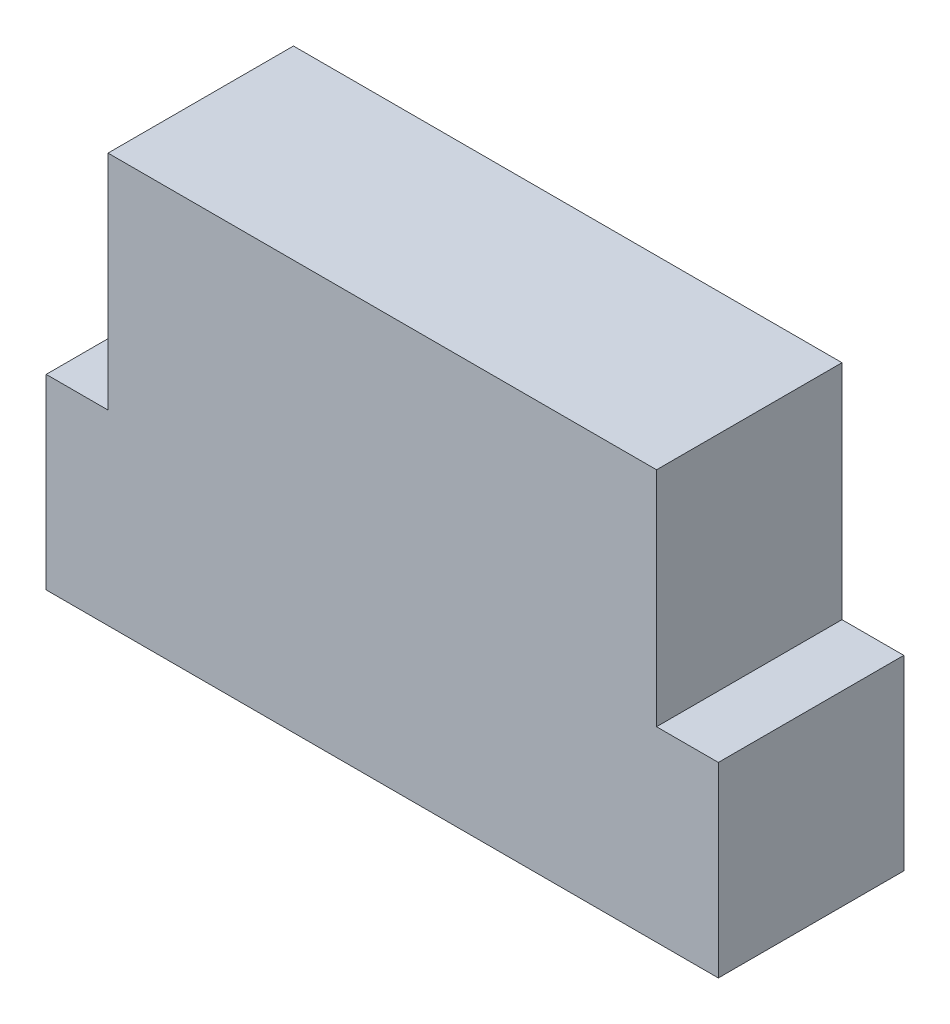
from build123d import *

# Parameters (mm, degrees)
EXTRUDE_1_DEPTH     = 2
EXTRUDE_5_DEPTH     = 12
SKETCH_3_R          = 2
EXTRUDE_6_DEPTH     = 12
CUT_EXTRUDE_1_DEPTH = 12
EXTRUDE_7_DEPTH     = 15
SKETCH_7_W          = 44.36597813
SKETCH_7_H          = 14
EXTRUDE_8_DEPTH     = 3
SKETCH_9_W          = 18.66
SKETCH_9_H          = 10
CUT_EXTRUDE_3_DEPTH = 1
EXTRUDE_9_DEPTH     = 1
SCALE_1_SCALE       = 0.1
SKETCH_11_W         = 1.5
SKETCH_11_H         = 1.51
EXTRUDE_10_DEPTH    = 0.5
SKETCH_12_W         = 1.5
SKETCH_12_H         = 1.51
EXTRUDE_11_DEPTH    = 0.5
SKETCH_13_W         = 5.436597812
SKETCH_13_H         = 1.51
EXTRUDE_12_DEPTH    = 1.5


with BuildPart() as part:
    # 스케치2 → 보스-돌출1 (new body)
    with BuildSketch(Plane.XY):
        Polygon((0, 0), (47.71, 0), (37.32, -17.996007891), (10.39, -17.996007891), align=None)
    extrude(amount=EXTRUDE_1_DEPTH)

    # 스케치4 → 보스-돌출5 (add)
    with BuildSketch(Plane.XY.offset(2)):
        Polygon((13.739529946, -17.996007891), (5.021540881, -2.896007891), (1.672010935, -2.896007891), (10.39, -17.996007891), align=None)
        Polygon((46.037989065, -2.896007891), (42.688459119, -2.896007891), (33.970470054, -17.996007891), (37.32, -17.996007891), align=None)
    extrude(amount=EXTRUDE_5_DEPTH)

    # 스케치3 → 보스-돌출6 (add)
    with BuildSketch(Plane.XY.offset(2)):
        with Locations(Location((15.355, -11.594084102, 0), (0, 0, 180))):
            Circle(SKETCH_3_R)
        with Locations((32.355, -11.594084102)):
            Circle(SKETCH_3_R)
    extrude(amount=EXTRUDE_6_DEPTH)

    # 스케치5 → 컷-돌출1 (cut)
    with BuildSketch(Plane.XY.offset(2)):
        Polygon((0, 0), (47.71, 0), (46.037989065, -2.896007891), (1.672010935, -2.896007891), align=None)
    extrude(amount=-CUT_EXTRUDE_1_DEPTH, mode=Mode.SUBTRACT)

    # 스케치6 → 보스-돌출7 (add)
    with BuildSketch(Plane(origin=(0, -2.896007891, 0), x_dir=(1, 0, 0), z_dir=(0, 1, 0))):
        Polygon((5.021540881, -14), (1.672010935, -14), (1.672010935, 0), (46.037989065, 0), (46.037989065, -14), (42.688459119, -14), (42.688459119, -2), (5.021540881, -2), align=None)
    extrude(amount=EXTRUDE_7_DEPTH)

    # 스케치7 → 보스-돌출8 (add)
    with BuildSketch(Plane(origin=(0, 12.103992109, 0), x_dir=(1, 0, 0), z_dir=(0, 1, 0))):
        with Locations((23.855, -7)):
            Rectangle(SKETCH_7_W, SKETCH_7_H)
    extrude(amount=EXTRUDE_8_DEPTH)

    # 스케치9 → 컷-돌출3 (cut)
    with BuildSketch(Plane.XZ.offset(-12.103992109)):
        with Locations((14.525, 8)):
            Rectangle(SKETCH_9_W, SKETCH_9_H)
        with Locations((33.185, 8)):
            Rectangle(SKETCH_9_W, SKETCH_9_H)
    extrude(amount=-CUT_EXTRUDE_3_DEPTH, mode=Mode.SUBTRACT)

    # 스케치10 → 보스-돌출9 (add)
    with BuildSketch(Plane.XY.offset(14)):
        Polygon((10.39, -17.996007891), (37.32, -17.996007891), (46.037989065, -2.896007891), (46.037989065, 15.103992109), (1.672010935, 15.103992109), (1.672010935, -2.896007891), align=None)
    extrude(amount=EXTRUDE_9_DEPTH)


with BuildPart() as part_1:
    # 축척1: scaled about (23.855, 0.64704732, 6.739732729)
    add(part.part.scale(SCALE_1_SCALE).moved(Location((21.4695, 0.582342588, 6.065759456))))

    # 스케치11 → 보스-돌출10 (add, symmetric)
    with BuildSketch(Plane.ZY.offset(-21.636701094)):
        with Locations((6.815759456, -0.462258201)):
            Rectangle(SKETCH_11_W, SKETCH_11_H)
    extrude(amount=EXTRUDE_10_DEPTH, both=True)

    # 스케치12 → 보스-돌출11 (add, symmetric)
    with BuildSketch(Plane(origin=(26.073298906, 0, 0), x_dir=(0, 0, -1), z_dir=(1, 0, 0))):
        with Locations((-6.815759456, -0.462258201)):
            Rectangle(SKETCH_12_W, SKETCH_12_H)
    extrude(amount=EXTRUDE_11_DEPTH, both=True)

    # 스케치13 → 보스-돌출12 (add)
    with BuildSketch(Plane(origin=(0, 0, 6.065759456), x_dir=(-1, 0, 0), z_dir=(0, 0, -1))):
        with Locations((-23.855, -0.462258201)):
            Rectangle(SKETCH_13_W, SKETCH_13_H)
    extrude(amount=-EXTRUDE_12_DEPTH)


solid = part_1.part
